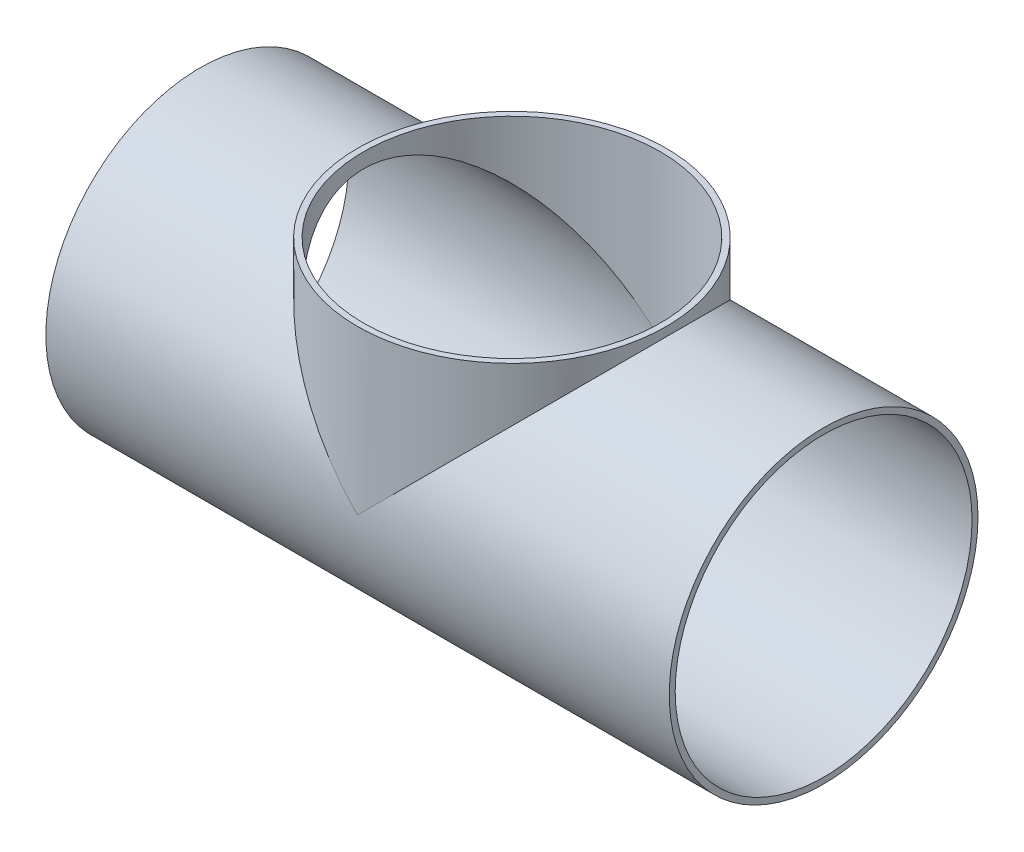
from build123d import *

# Parameters (mm, degrees)
SKETCH1_W                  = 210
SKETCH1_H                  = 52
SKETCH2_W                  = 52
SKETCH2_H                  = 55
M90_CLEARANCE_HOLE1_D      = 100
M90_CLEARANCE_HOLE2_REACH  = 243.357
M90_CLEARANCE_HOLE2_BORE_R = 50


with BuildPart() as part:
    # Sketch1 → Revolve1 (revolve)
    with BuildSketch(Plane.XY, mode=Mode.PRIVATE) as revolve1_sk:
        with Locations((105, 26)):
            Rectangle(SKETCH1_W, SKETCH1_H)
    revolve(revolve1_sk.sketch.rotate(Axis((0, 0, 0), (1, 0, 0)), 270), axis=Axis((0, 0, 0), (1, 0, 0)))

    # Sketch2 → Revolve2 (revolve)
    with BuildSketch(Plane.XY, mode=Mode.PRIVATE) as revolve2_sk:
        with Locations((79, 27.5)):
            Rectangle(SKETCH2_W, SKETCH2_H)
    revolve(revolve2_sk.sketch.rotate(Axis((105, 0, 0), (0, 1, 0)), 90), axis=Axis((105, 0, 0), (0, 1, 0)))

    # M90 Clearance Hole1 (through all)
    with Locations(Plane(origin=(210, 0, 0), x_dir=(0, 0, -1), z_dir=(1, 0, 0))):
        with Locations((0, 0)):
            Hole(M90_CLEARANCE_HOLE1_D / 2)

    # M90 Clearance Hole2 bore → M90 Clearance Hole2 (cut, up to next)
    with BuildSketch(Plane(origin=(0, 55, 0), x_dir=(1, 0, 0), z_dir=(0, 1, 0)), mode=Mode.PRIVATE) as m90_clearance_hole2_sk1:
        with Locations((105, 0)):
            Circle(M90_CLEARANCE_HOLE2_BORE_R)
    m90_clearance_hole2_tool1 = extrude(m90_clearance_hole2_sk1.sketch, amount=-M90_CLEARANCE_HOLE2_REACH, mode=Mode.PRIVATE) & part.part
    add(m90_clearance_hole2_tool1.solids().sort_by_distance((105, 55, 0))[0], mode=Mode.SUBTRACT)


solid = part.part
